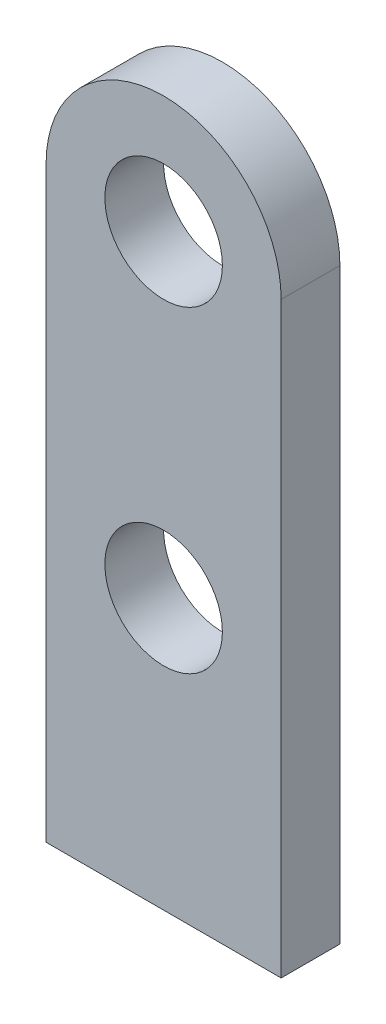
from build123d import *

# Parameters (mm, degrees)
SKETCH_1_R      = 10
EXTRUDE_2_DEPTH = 10


with BuildPart() as part:
    # 草图1 → 凸台-拉伸2 (new body)
    with BuildSketch(Plane.XY):
        with BuildLine():
            ThreePointArc((20, 0), (0, 20), (-20, 0))
            Line((-20, 0), (-20, -100))
            Line((-20, -100), (20, -100))
            Line((20, -100), (20, 0))
        make_face()
        Circle(SKETCH_1_R, mode=Mode.SUBTRACT)
        with Locations((0, -54)):
            Circle(SKETCH_1_R, mode=Mode.SUBTRACT)
    extrude(amount=EXTRUDE_2_DEPTH)


solid = part.part
